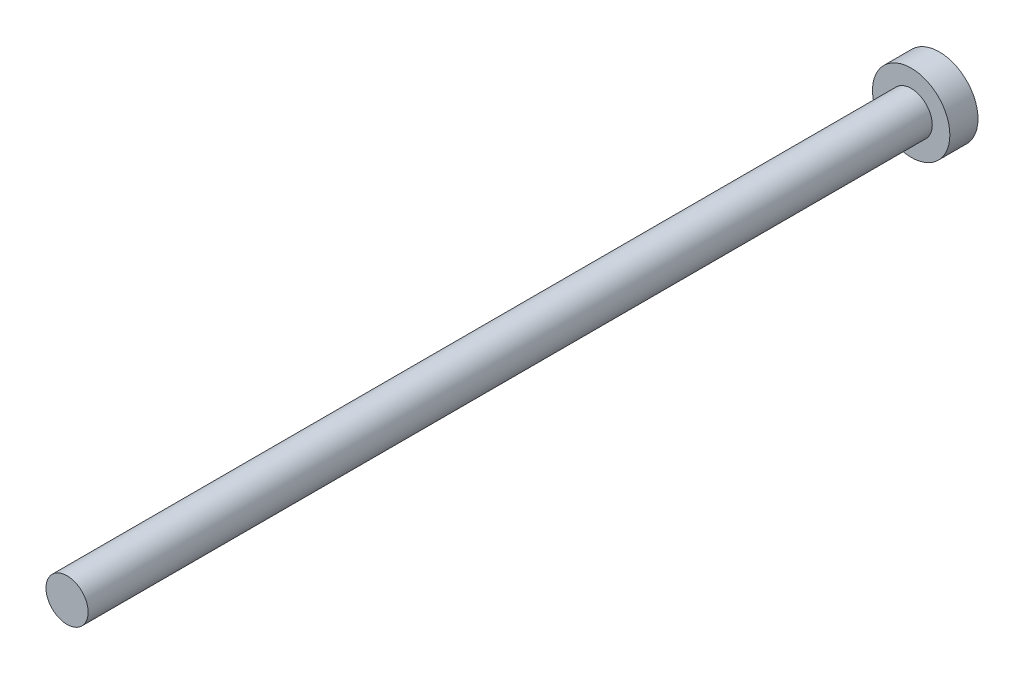
from build123d import *

# Parameters (mm, degrees)
M3X60_START       = -26
SKETCH_1_R        = 1.5
M3X60_DEPTH       = 60
EXTRUDE_START     = -28
SKETCH_2_R        = 2.75
EXTRUDE_271_DEPTH = 2


with BuildPart() as part:
    # 草图1 → M3x60光杆转轴简化 (new body)
    with BuildSketch(Plane.XY.offset(M3X60_START)):
        Circle(SKETCH_1_R)
    extrude(amount=M3X60_DEPTH)

    # 草图2 → Extrude 271 (add)
    with BuildSketch(Plane.XY.offset(EXTRUDE_START)):
        Circle(SKETCH_2_R)
    extrude(amount=EXTRUDE_271_DEPTH)


solid = part.part
